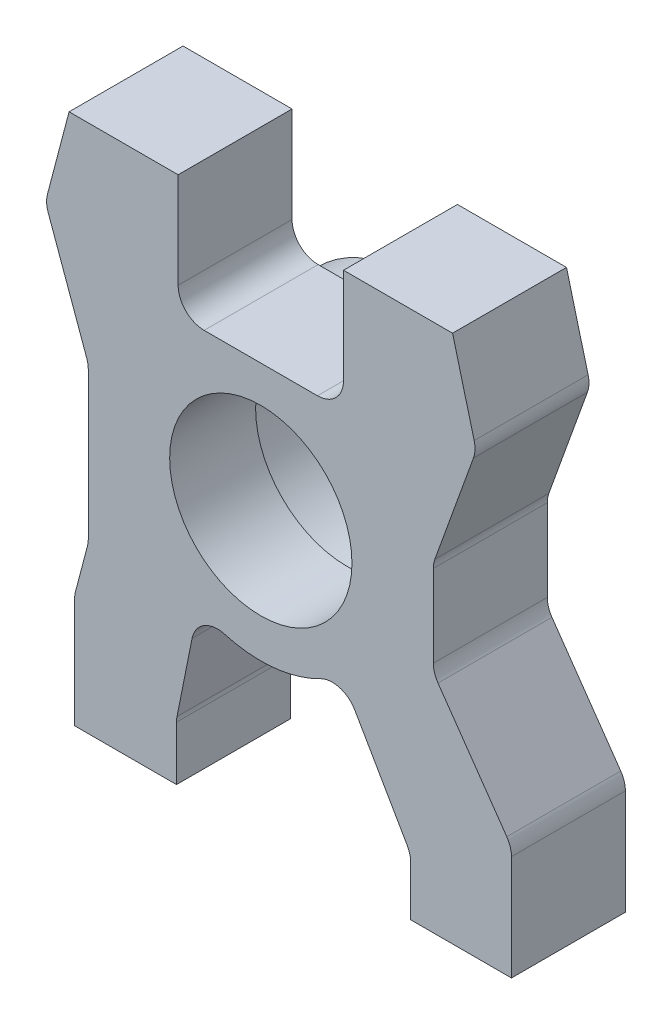
from build123d import *

# Parameters (mm, degrees)
SKETCH1_R           = 7.112
BOSS_EXTRUDE1_DEPTH = 8.89
SKETCH2_R           = 8.1026
BOSS_EXTRUDE2_DEPTH = 2.794
CUT_EXTRUDE1_START  = -2.1844
SKETCH4_R           = 8.1026
CUT_EXTRUDE1_DEPTH  = 2.1844
SKETCH5_R           = 1.4605
CUT_EXTRUDE2_DEPTH  = 7.62


with BuildPart() as part:
    # Sketch1 → Boss-Extrude1 (new body)
    with BuildSketch(Plane.XY):
        with BuildLine():
            Line((4.4196, 9.970322522), (-4.4196, 9.970322522))
            ThreePointArc((-4.4196, 9.970322522), (-5.856440979, 10.565481542), (-6.4516, 12.002322522))
            Line((-6.4516, 12.002322522), (-6.4516, 19.469922522))
            Line((-6.4516, 19.469922522), (-14.9606, 19.469922522))
            Line((-14.9606, 19.469922522), (-16.647754284, 13.056434928))
            ThreePointArc((-16.647754284, 13.056434928), (-16.712590479, 12.448835423), (-16.593859144, 11.849432587))
            Line((-16.593859144, 11.849432587), (-13.582754018, 3.50945712))
            ThreePointArc((-13.582754018, 3.50945712), (-13.492416148, 3.169677348), (-13.462, 2.819411617))
            Line((-13.462, 2.819411617), (-13.462, 0))
            Line((-13.462, 0), (-13.462, -8.647780438))
            ThreePointArc((-13.462, -8.647780438), (-13.478784036, -8.908411634), (-13.528858878, -9.164737275))
            Line((-13.528858878, -9.164737275), (-14.461941122, -12.711722544))
            ThreePointArc((-14.461941122, -12.711722544), (-14.512015964, -12.968048185), (-14.5288, -13.228679381))
            Line((-14.5288, -13.228679381), (-14.5288, -21.805077478))
            Line((-14.5288, -21.805077478), (-6.5786, -21.805077478))
            Line((-6.5786, -21.805077478), (-6.5786, -17.586954898))
            ThreePointArc((-6.5786, -17.586954898), (-6.568684578, -17.386460615), (-6.539035081, -17.187923011))
            Line((-6.539035081, -17.187923011), (-5.363383159, -11.317690055))
            ThreePointArc((-5.363383159, -11.317690055), (-4.426978503, -9.980685151), (-2.809123398, -9.763934951))
            ThreePointArc((-2.809123398, -9.763934951), (0.991075795, -10.11154631), (4.651460928, -9.032691251))
            ThreePointArc((4.651460928, -9.032691251), (6.155731201, -8.889980119), (7.342613103, -9.82513084))
            Line((7.342613103, -9.82513084), (11.42555999, -16.91467556))
            ThreePointArc((11.42555999, -16.91467556), (11.62774502, -17.403914002), (11.6967, -17.928774222))
            Line((11.6967, -17.928774222), (11.6967, -21.805077478))
            Line((11.6967, -21.805077478), (19.558, -21.805077478))
            Line((19.558, -21.805077478), (19.558, -13.603952816))
            ThreePointArc((19.558, -13.603952816), (19.464666148, -12.995185564), (19.193238615, -12.442342123))
            Line((19.193238615, -12.442342123), (13.826761385, -4.739935355))
            ThreePointArc((13.826761385, -4.739935355), (13.555333852, -4.187091915), (13.462, -3.578324662))
            Line((13.462, -3.578324662), (13.462, 0))
            Line((13.462, 0), (13.462, 2.819411617))
            ThreePointArc((13.462, 2.819411617), (13.492416148, 3.169677348), (13.582754018, 3.50945712))
            Line((13.582754018, 3.50945712), (16.593859144, 11.849432587))
            ThreePointArc((16.593859144, 11.849432587), (16.712590479, 12.448835423), (16.647754284, 13.056434928))
            Line((16.647754284, 13.056434928), (14.9606, 19.469922522))
            Line((14.9606, 19.469922522), (6.4516, 19.469922522))
            Line((6.4516, 19.469922522), (6.4516, 12.002322522))
            ThreePointArc((6.4516, 12.002322522), (5.856440979, 10.565481542), (4.4196, 9.970322522))
        make_face()
        Circle(SKETCH1_R, mode=Mode.SUBTRACT)
    extrude(amount=BOSS_EXTRUDE1_DEPTH)

    # Sketch2 → Boss-Extrude2 (add)
    with BuildSketch(Plane(origin=(0, 0, 0), x_dir=(-1, 0, 0), z_dir=(0, 0, -1))):
        with BuildLine():
            Line((-1.42116995, 9.970322522), (1.42116995, 9.970322522))
            ThreePointArc((1.42116995, 9.970322522), (0, -10.0711), (-1.42116995, 9.970322522))
        make_face()
        Circle(SKETCH2_R, mode=Mode.SUBTRACT)
    extrude(amount=BOSS_EXTRUDE2_DEPTH)

    # Sketch4 → Cut-Extrude1 (cut)
    with BuildSketch(Plane(origin=(0, 0, 0), x_dir=(-1, 0, 0), z_dir=(0, 0, -1)).offset(CUT_EXTRUDE1_START)):
        Circle(SKETCH4_R)
    extrude(amount=CUT_EXTRUDE1_DEPTH, mode=Mode.SUBTRACT)

    # Sketch5 → Cut-Extrude2 (cut)
    with BuildSketch(Plane.XZ.offset(21.805077478)):
        with Locations(Location((-10.668, 4.445, 0), (0, 0, 270))):
            Circle(SKETCH5_R)
        with Locations(Location((15.6972, 4.445, 0), (0, 0, 270))):
            Circle(SKETCH5_R)
    extrude(amount=-CUT_EXTRUDE2_DEPTH, mode=Mode.SUBTRACT)


solid = part.part
